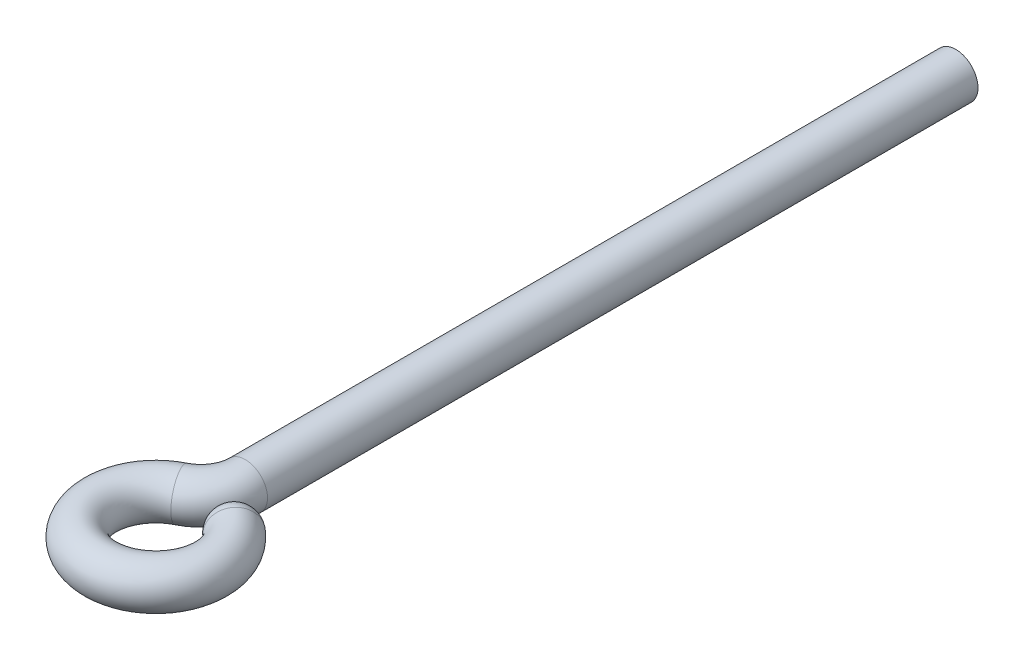
from build123d import *

# Parameters (mm, degrees)
SKETCH1_R           = 1
BOSS_EXTRUDE1_DEPTH = 30
SKETCH1_2_R         = 1
DOME2_FACE_RADIUS   = 1
DOME2_HEIGHT        = 1


with BuildPart() as part:
    # Sketch1 → Boss-Extrude1 (new body)
    with BuildSketch(Plane.XY):
        Circle(SKETCH1_R)
    extrude(amount=-BOSS_EXTRUDE1_DEPTH)

    # Sweep1: sweep along a path in Sketch3
    with BuildLine(Plane(origin=(0, 0, 0), x_dir=(1, 0, 0), z_dir=(0, 1, 0))) as sweep1_path:
        Line((0, 0), (0, -2))
        ThreePointArc((0, -2), (-0.300326829, -3.054092553), (-1.111111111, -3.791612833))
        ThreePointArc((-1.111111111, -3.791612833), (-0.29627421, -8.513511116), (1.606969024, -4.116017766))
    # Sketch1<2> → Sweep1 (sweep)
    with BuildSketch(Plane.XY):
        Circle(SKETCH1_2_R)
    sweep(path=sweep1_path.line)

    # Dome2: a dome of height H over a round flat face of radius A is a cap of a sphere of radius (A * A + H * H) / (2 * H)
    dome2_r = (DOME2_FACE_RADIUS * DOME2_FACE_RADIUS + DOME2_HEIGHT * DOME2_HEIGHT) / (2 * DOME2_HEIGHT)
    dome2_base = Plane((1.606969024, 0, 4.116017766), z_dir=(-0.766044443119, 0, -0.642787609687))
    with Locations(dome2_base.offset(DOME2_HEIGHT - dome2_r)):
        dome2_ball = Sphere(dome2_r, mode=Mode.PRIVATE)
    add(split(dome2_ball, bisect_by=dome2_base, keep=Keep.TOP, mode=Mode.PRIVATE))


solid = part.part
